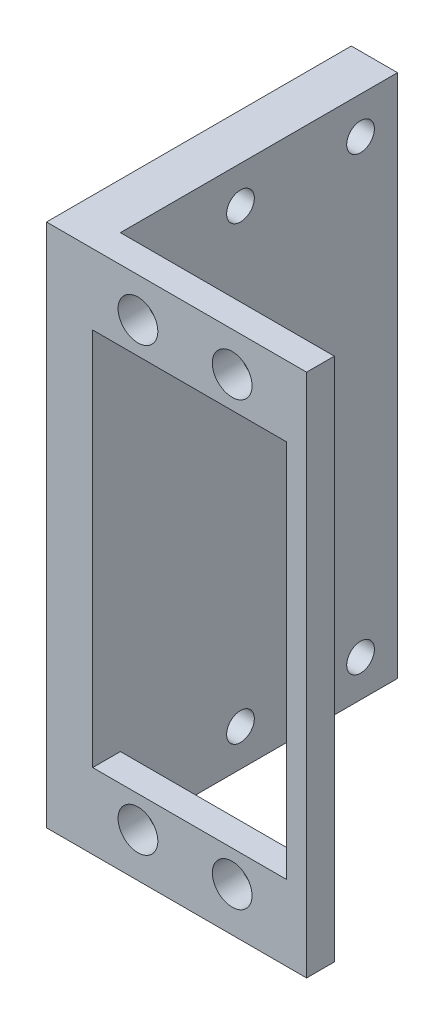
from build123d import *

# Parameters (mm, degrees)
SKETCH1_W                = 23.157887254
SKETCH1_H                = 56.803269144
BOSS_EXTRUDE1_DEPTH      = 3
SKETCH2_W                = 21.565447853
SKETCH2_H                = 41.02848808
CUT_EXTRUDE1_DEPTH       = 3
BOSS_EXTRUDE2_DEPTH      = 30
BOSS_EXTRUDE2_DEPTH_BACK = 3
SKETCH3_W                = 5
SKETCH3_H                = 56.803269144
SKETCH4_R                = 2.15
CUT_EXTRUDE2_DEPTH       = 10
SKETCH5_R                = 1.5
CUT_EXTRUDE3_DEPTH       = 10


with BuildPart() as part:
    # Sketch1 → Boss-Extrude1 (new body)
    with BuildSketch(Plane.XY):
        with Locations((0.125421965, -10.791955708)):
            Rectangle(SKETCH1_W, SKETCH1_H)
    extrude(amount=BOSS_EXTRUDE1_DEPTH)

    # Sketch2 → Cut-Extrude1 (cut)
    with BuildSketch(Plane.XY.offset(3)):
        with Locations((-1.253966293, -10.527428418)):
            Rectangle(SKETCH2_W, SKETCH2_H)
    extrude(amount=-CUT_EXTRUDE1_DEPTH, mode=Mode.SUBTRACT)

    # Sketch3 → Boss-Extrude2 (add, two sides: drawn at the far end of the back side and taken through both)
    with BuildSketch(Plane(origin=(0, 0, 0), x_dir=(-1, 0, 0), z_dir=(0, 0, -1)).offset(-BOSS_EXTRUDE2_DEPTH_BACK)):
        with Locations((13.953521662, -10.791955708)):
            Rectangle(SKETCH3_W, SKETCH3_H)
    extrude(amount=BOSS_EXTRUDE2_DEPTH + BOSS_EXTRUDE2_DEPTH_BACK)

    # Sketch4 → Cut-Extrude2 (cut)
    with BuildSketch(Plane(origin=(0, 0, 0), x_dir=(-1, 0, 0), z_dir=(0, 0, -1))):
        with Locations((-3.646478338, 13.372571582)):
            Circle(SKETCH4_R)
        with Locations((6.553521662, 13.372571582)):
            Circle(SKETCH4_R)
        with Locations((-3.646478338, -34.427428418)):
            Circle(SKETCH4_R)
        with Locations((6.553521662, -34.427428418)):
            Circle(SKETCH4_R)
    extrude(amount=-CUT_EXTRUDE2_DEPTH, mode=Mode.SUBTRACT)

    # Sketch5 → Cut-Extrude3 (cut)
    with BuildSketch(Plane(origin=(-11.453521662, 0, 0), x_dir=(0, 0, -1), z_dir=(1, 0, 0))):
        with Locations((26, 13.609678864)):
            Circle(SKETCH5_R)
        with Locations((13, 13.609678864)):
            Circle(SKETCH5_R)
        with Locations(Location((26, -35.19359028, 0), (0, 0, 180))):
            Circle(SKETCH5_R)
        with Locations(Location((13, -35.19359028, 0), (0, 0, 180))):
            Circle(SKETCH5_R)
    extrude(amount=-CUT_EXTRUDE3_DEPTH, mode=Mode.SUBTRACT)


solid = part.part
